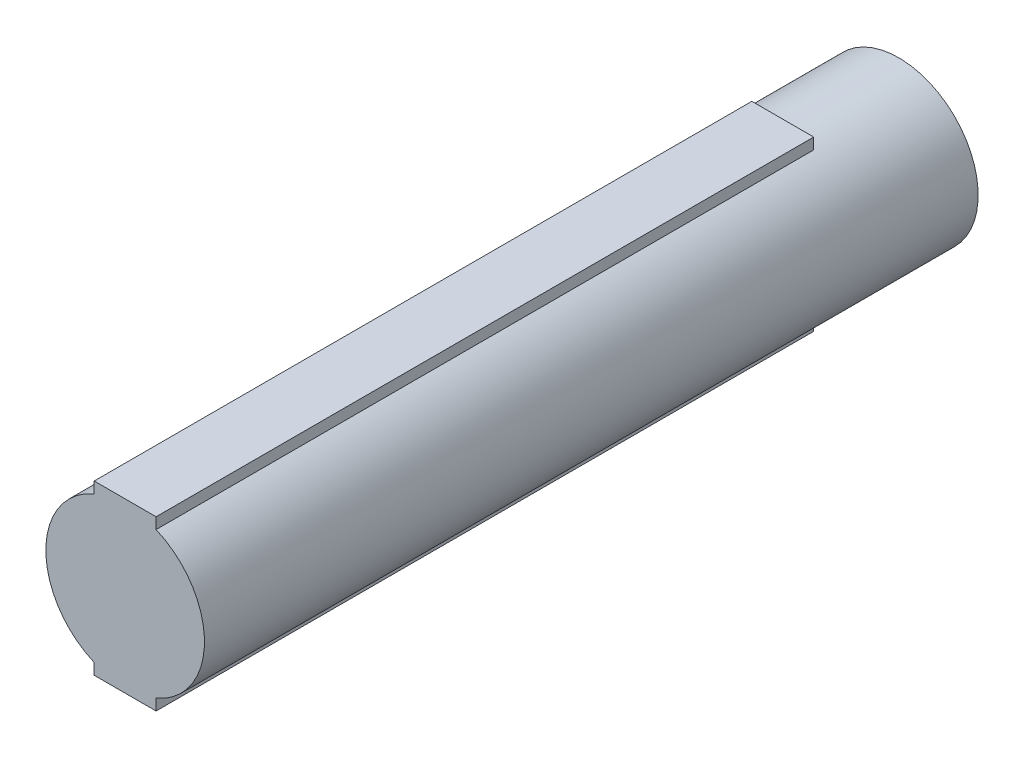
from build123d import *
from build123d.topology import SkipClean

# Parameters (mm, degrees)
SKETCH1_R                = 2
BOSS_EXTRUDE1_DEPTH      = 7
SKETCH3_R                = 2
SKETCH3_W                = 4.25
SKETCH3_H                = 1.5
BOSS_EXTRUDE3_DEPTH      = 4
BOSS_EXTRUDE4_START      = 4
BOSS_EXTRUDE4_DEPTH      = 4
BOSS_EXTRUDE5_START      = -8
BOSS_EXTRUDE5_DEPTH      = 8
CUT_EXTRUDE1_START       = -8
CUT_EXTRUDE1_DEPTH       = 8
CUT_EXTRUDE2_DEPTH       = 7
BOSS_EXTRUDE6_DEPTH      = 8
BOSS_EXTRUDE6_DEPTH_BACK = 3
SKETCH2_R                = 2.05
SKETCH2_R_2              = 2
BOSS_EXTRUDE7_START      = -8
BOSS_EXTRUDE7_DEPTH      = 8
BOSS_EXTRUDE8_DEPTH      = 9
BOSS_EXTRUDE8_DEPTH_BACK = 7
SKETCH11_R               = 2.05
BOSS_EXTRUDE9_DEPTH      = 9
FILLET1_R                = 0.1


with BuildPart() as part:
    # Sketch1 → Boss-Extrude1 (new body)
    with BuildSketch(Plane.XY):
        Circle(SKETCH1_R)
        with BuildLine():
            ThreePointArc((-1.5, 0), (-1.401258538, 0.535233135), (-1.118033989, 1))
            Line((-1.118033989, 1), (1.118033989, 1))
            ThreePointArc((1.118033989, 1), (1.401258538, 0.535233135), (1.5, 0))
            ThreePointArc((1.5, 0), (0, -1.5), (-1.5, 0))
        make_face(mode=Mode.SUBTRACT)
    extrude(amount=BOSS_EXTRUDE1_DEPTH)

    # Sketch3 → Boss-Extrude3 (add)
    with BuildSketch(Plane.XY.offset(7)):
        with Locations(Location((0, 0, 0), (0, 0, 157.975687163))):
            Circle(SKETCH3_R)
        Rectangle(SKETCH3_W, SKETCH3_H)
    extrude(amount=BOSS_EXTRUDE3_DEPTH)

    # Sketch4 → Boss-Extrude4 (add)
    with BuildSketch(Plane(origin=(0, 0, 7), x_dir=(-1, 0, 0), z_dir=(0, 0, -1)).offset(BOSS_EXTRUDE4_START)):
        with BuildLine():
            Line((-2.125, -0.75), (-1.854049622, -0.75))
            ThreePointArc((-1.854049622, -0.75), (-2, 0), (-1.854049622, 0.75))
            Line((-1.854049622, 0.75), (-2.125, 0.75))
            Line((-2.125, 0.75), (-2.125, -0.75))
        make_face()
        with BuildLine():
            Line((2.125, 0.75), (1.854049622, 0.75))
            ThreePointArc((1.854049622, 0.75), (2, 0), (1.854049622, -0.75))
            Line((1.854049622, -0.75), (2.125, -0.75))
            Line((2.125, -0.75), (2.125, 0.75))
        make_face()
    extrude(amount=-BOSS_EXTRUDE4_DEPTH)

    # Sketch6 → Boss-Extrude5 (add)
    with BuildSketch(Plane.XY.offset(11).offset(BOSS_EXTRUDE5_START)):
        with BuildLine():
            Line((-0.75, -1.854049622), (-0.75, -2.125))
            Line((-0.75, -2.125), (0.75, -2.125))
            Line((0.75, -2.125), (0.75, -1.854049622))
            ThreePointArc((0.75, -1.854049622), (0, -2), (-0.75, -1.854049622))
        make_face()
        with BuildLine():
            Line((0.75, 1.854049622), (0.75, 2.125))
            Line((0.75, 2.125), (-0.75, 2.125))
            Line((-0.75, 2.125), (-0.75, 1.854049622))
            ThreePointArc((-0.75, 1.854049622), (0, 2), (0.75, 1.854049622))
        make_face()
    extrude(amount=BOSS_EXTRUDE5_DEPTH)

    # Sketch7 → Cut-Extrude1 (cut)
    with SkipClean():  # the faces are left unmerged after this step: merging them gives an invalid solid
        with BuildSketch(Plane.XY.offset(11).offset(CUT_EXTRUDE1_START)):
            with BuildLine():
                Line((-2.125, -0.75), (-1.854049622, -0.75))
                ThreePointArc((-1.854049622, -0.75), (-2, 0), (-1.854049622, 0.75))
                Line((-1.854049622, 0.75), (-2.125, 0.75))
                Line((-2.125, 0.75), (-2.125, -0.75))
            make_face()
            with BuildLine():
                Line((1.854049622, -0.75), (2.125, -0.75))
                Line((2.125, -0.75), (2.125, 0.75))
                Line((2.125, 0.75), (1.854049622, 0.75))
                ThreePointArc((1.854049622, 0.75), (2, 0), (1.854049622, -0.75))
            make_face()
        extrude(amount=CUT_EXTRUDE1_DEPTH, mode=Mode.SUBTRACT)

    # Sketch8 → Cut-Extrude2 (cut)
    with SkipClean():  # the faces are left unmerged after this step: merging them gives an invalid solid
        with BuildSketch(Plane(origin=(0, 0, 0), x_dir=(-1, 0, 0), z_dir=(0, 0, -1))):
            with BuildLine():
                Line((-1.183215957, 1.15), (1.183215957, 1.15))
                ThreePointArc((1.183215957, 1.15), (0, -1.65), (-1.183215957, 1.15))
            make_face()
            with BuildLine():
                Line((-1.118033989, 1), (1.118033989, 1))
                ThreePointArc((1.118033989, 1), (0, -1.5), (-1.118033989, 1))
            make_face(mode=Mode.SUBTRACT)
        extrude(amount=-CUT_EXTRUDE2_DEPTH, mode=Mode.SUBTRACT)

    # Sketch2 → Boss-Extrude6 (add, two sides: drawn at the far end of the back side and taken through both)
    with BuildSketch(Plane.XY.offset(3).offset(-BOSS_EXTRUDE6_DEPTH_BACK)):
        Circle(SKETCH2_R)
        Circle(SKETCH2_R_2, mode=Mode.SUBTRACT)
    extrude(amount=BOSS_EXTRUDE6_DEPTH + BOSS_EXTRUDE6_DEPTH_BACK)

    # Sketch10 → Boss-Extrude7 (add)
    with BuildSketch(Plane(origin=(0, 0, 3), x_dir=(-1, 0, 0), z_dir=(0, 0, -1)).offset(BOSS_EXTRUDE7_START)):
        with BuildLine():
            Line((0.75, -1.907878403), (0.75, -2.125))
            Line((0.75, -2.125), (-0.75, -2.125))
            Line((-0.75, -2.125), (-0.75, -1.907878403))
            ThreePointArc((-0.75, -1.907878403), (-0.77506725, -1.897833174), (-0.8, -1.887458609))
            Line((-0.8, -1.887458609), (-0.8, -2.175))
            Line((-0.8, -2.175), (0.8, -2.175))
            Line((0.8, -2.175), (0.8, -1.887458609))
            ThreePointArc((0.8, -1.887458609), (0.77506725, -1.897833174), (0.75, -1.907878403))
        make_face()
        with BuildLine():
            Line((-0.8, 2.175), (-0.8, 1.887458609))
            ThreePointArc((-0.8, 1.887458609), (-0.77506725, 1.897833174), (-0.75, 1.907878403))
            Line((-0.75, 1.907878403), (-0.75, 2.125))
            Line((-0.75, 2.125), (0.75, 2.125))
            Line((0.75, 2.125), (0.75, 1.907878403))
            ThreePointArc((0.75, 1.907878403), (0.77506725, 1.897833174), (0.8, 1.887458609))
            Line((0.8, 1.887458609), (0.8, 2.175))
            Line((0.8, 2.175), (-0.8, 2.175))
        make_face()
    extrude(amount=BOSS_EXTRUDE7_DEPTH)

    # Sketch11 → Boss-Extrude8 (add, two sides: drawn at the far end of the back side and taken through both)
    with BuildSketch(Plane(origin=(0, 0, 0), x_dir=(-1, 0, 0), z_dir=(0, 0, -1)).offset(-BOSS_EXTRUDE8_DEPTH_BACK)):
        with Locations(Location((0, 0, 0), (0, 0, 112.969676572))):
            Circle(SKETCH11_R)
        with BuildLine():
            Line((-1.207269647, 1.05), (1.207269647, 1.05))
            ThreePointArc((1.207269647, 1.05), (0, -1.6), (-1.207269647, 1.05))
        make_face(mode=Mode.SUBTRACT)
    extrude(amount=BOSS_EXTRUDE8_DEPTH + BOSS_EXTRUDE8_DEPTH_BACK)

    # Sketch12 → Boss-Extrude9 (add)
    with BuildSketch(Plane(origin=(0, 0, 3), x_dir=(-1, 0, 0), z_dir=(0, 0, -1))):
        with BuildLine():
            Line((-0.8, 2.175), (-0.8, 1.887458609))
            ThreePointArc((-0.8, 1.887458609), (0, 2.05), (0.8, 1.887458609))
            Line((0.8, 1.887458609), (0.8, 2.175))
            Line((0.8, 2.175), (-0.8, 2.175))
        make_face()
        with BuildLine():
            Line((0.8, -2.175), (0.8, -1.887458609))
            ThreePointArc((0.8, -1.887458609), (0, -2.05), (-0.8, -1.887458609))
            Line((-0.8, -1.887458609), (-0.8, -2.175))
            Line((-0.8, -2.175), (0.8, -2.175))
        make_face()
    extrude(amount=BOSS_EXTRUDE9_DEPTH)

    # Fillet1
    fillet1_edges = [part.edges().sort_by_distance(p)[0] for p in [
        (1.207269647, 1.05, -4.5),
        (-1.207269647, 1.05, -4.5),
    ]]
    fillet(fillet1_edges, radius=FILLET1_R)


solid = part.part
